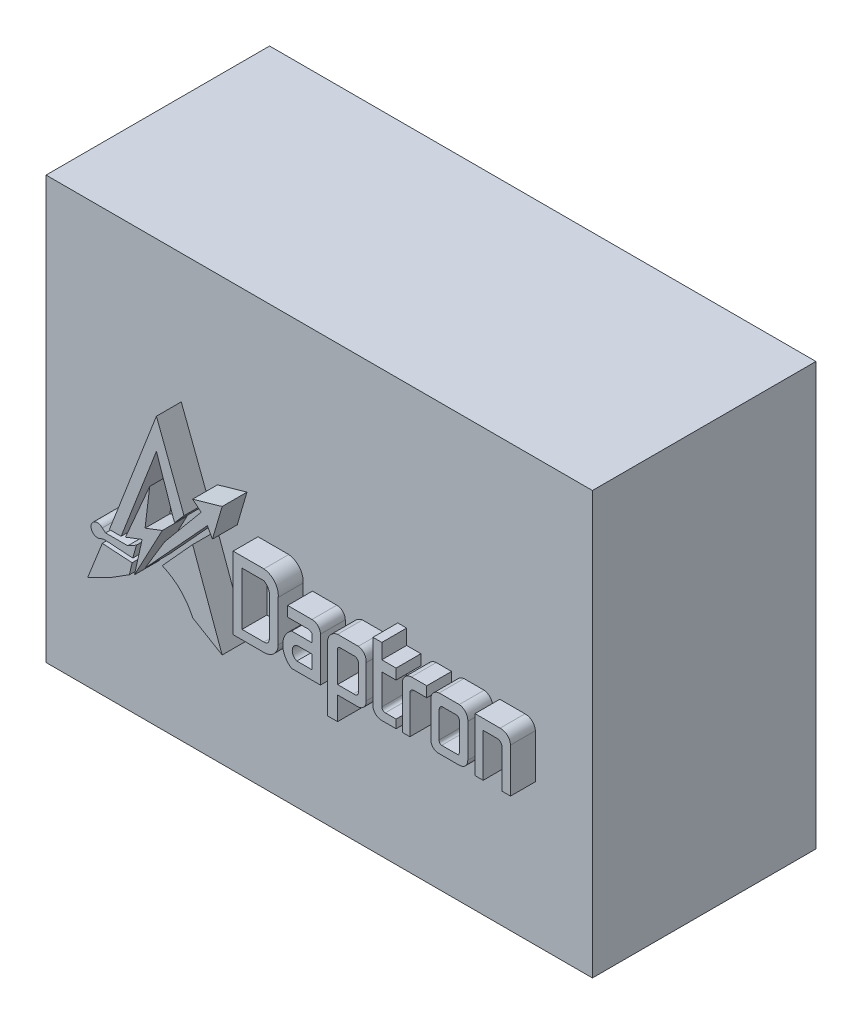
from build123d import *

# Parameters (mm, degrees)
BOSS_EXTRU_1_DEPTH    = 10
BOSS_EXTRU_1_2_DEPTH  = 10
BOSS_EXTRU_1_3_DEPTH  = 10
BOSS_EXTRU_1_4_DEPTH  = 10
BOSS_EXTRU_1_5_DEPTH  = 10
BOSS_EXTRU_1_6_DEPTH  = 10
BOSS_EXTRU_1_7_DEPTH  = 10
BOSS_EXTRU_1_8_DEPTH  = 10
BOSS_EXTRU_1_9_DEPTH  = 10
BOSS_EXTRU_1_10_DEPTH = 10
BOSS_EXTRU_1_11_DEPTH = 10
BOSS_EXTRU_1_12_DEPTH = 10
BOSS_EXTRU_1_13_DEPTH = 10
ESQUISSE2_W           = 22
ESQUISSE2_H           = 17
BOSS_EXTRU_2_DEPTH    = 9


with BuildPart() as part:
    # Esquisse1 → Boss.-Extru.1 (new body)
    with BuildSketch(Plane.XY):
        Polygon((5.443717547, 11.812499229), (3.550061207, 6.914484272), (4.023475292, 6.914484272), (5.443717547, 10.587995489), (6.172046909, 8.462184165), (6.554419824, 8.899181782), align=None)
    extrude(amount=BOSS_EXTRU_1_DEPTH)



with BuildPart() as body_2:
    # Esquisse1 → Boss.-Extru.1 2 (new body)
    with BuildSketch(Plane.XY):
        with BuildLine():
            Line((6.902626833, 8.065470566), (5.678236467, 6.71845465))
            ThreePointArc((5.678236467, 6.71845465), (6.407694377, 6.234618767), (6.902626833, 5.512643789))
            Line((6.902626833, 5.512643789), (8.09044996, 4.808141168))
            Line((8.09044996, 4.808141168), (6.902626833, 8.065470566))
        make_face()
    extrude(amount=BOSS_EXTRU_1_2_DEPTH)


with BuildPart() as body_3:
    # Esquisse1 → Boss.-Extru.1 3 (new body)
    with BuildSketch(Plane.XY):
        Polygon((7.496538396, 9.023251364), (4.987277184, 6.289858676), (5.776031703, 7.600137795), (7.245503612, 9.363504086), (6.902626833, 9.649234735), (8.09044996, 9.988029647), (7.698590784, 8.65325933), align=None)
    extrude(amount=BOSS_EXTRU_1_3_DEPTH)


with BuildPart() as body_4:
    # Esquisse1 → Boss.-Extru.1 4 (new body)
    with BuildSketch(Plane.XY):
        with BuildLine():
            ThreePointArc((19.283756817, 7.855107538), (19.571781089, 7.751485217), (19.70217296, 7.474549255))
            Line((19.70217296, 7.474549255), (19.70217296, 5.694123098))
            Line((19.70217296, 5.694123098), (19.357163158, 5.694123098))
            Line((19.357163158, 5.694123098), (19.357163158, 7.183832057))
            ThreePointArc((19.357163158, 7.183832057), (19.328585973, 7.343227565), (19.195669208, 7.435730089))
            Line((19.195669208, 7.435730089), (18.601077847, 7.435730089))
            Line((18.601077847, 7.435730089), (18.601077847, 5.694123098))
            Line((18.601077847, 5.694123098), (18.270749313, 5.694123098))
            Line((18.270749313, 5.694123098), (18.270749313, 7.855107538))
            Line((18.270749313, 7.855107538), (19.283756817, 7.855107538))
        make_face()
    extrude(amount=BOSS_EXTRU_1_4_DEPTH)


with BuildPart() as body_5:
    # Esquisse1 → Boss.-Extru.1 5 (new body)
    with BuildSketch(Plane.XY):
        with BuildLine():
            Line((16.494479646, 7.435730089), (16.494479646, 6.027121876))
            ThreePointArc((16.494479646, 6.027121876), (16.601754173, 5.813714283), (16.828510675, 5.738666872))
            Line((16.828510675, 5.738666872), (17.640470987, 5.738666872))
            ThreePointArc((17.640470987, 5.738666872), (17.880768825, 5.838201495), (17.980303448, 6.078499332))
            Line((17.980303448, 6.078499332), (17.980303448, 7.435730089))
            ThreePointArc((17.980303448, 7.435730089), (17.896289803, 7.716195302), (17.638564331, 7.855107538))
            Line((17.638564331, 7.855107538), (16.828516054, 7.855107538))
            ThreePointArc((16.828516054, 7.855107538), (16.574641936, 7.714600019), (16.494479646, 7.435730089))
        make_face()
        with BuildLine():
            Line((17.638564331, 7.273362699), (17.638564331, 6.215464578))
            ThreePointArc((17.638564331, 6.215464578), (17.633763509, 6.142841489), (17.599745165, 6.078499332))
            Line((17.599745165, 6.078499332), (16.929772089, 6.078499332))
            ThreePointArc((16.929772089, 6.078499332), (16.85077764, 6.126011144), (16.828516054, 6.215464578))
            Line((16.828516054, 6.215464578), (16.828516054, 7.273362699))
            ThreePointArc((16.828516054, 7.273362699), (16.85715067, 7.368261985), (16.929772089, 7.435730089))
            Line((16.929772089, 7.435730089), (17.537308296, 7.435730089))
            ThreePointArc((17.537308296, 7.435730089), (17.621563701, 7.375517206), (17.638564331, 7.273362699))
        make_face(mode=Mode.SUBTRACT)
    extrude(amount=BOSS_EXTRU_1_5_DEPTH)


with BuildPart() as body_6:
    # Esquisse1 → Boss.-Extru.1 6 (new body)
    with BuildSketch(Plane.XY):
        with BuildLine():
            ThreePointArc((15.811686316, 7.435730089), (15.697522048, 7.386612234), (15.651527288, 7.271154337))
            Line((15.651527288, 7.271154337), (15.651527288, 5.738666872))
            Line((15.651527288, 5.738666872), (15.345769144, 5.738666872))
            Line((15.345769144, 5.738666872), (15.345769144, 7.435730089))
            ThreePointArc((15.345769144, 7.435730089), (15.440912126, 7.720805224), (15.709766935, 7.855107538))
            Line((15.709766935, 7.855107538), (16.328563178, 7.855107538))
            Line((16.328563178, 7.855107538), (16.328563178, 7.435730089))
            Line((16.328563178, 7.435730089), (15.811686316, 7.435730089))
        make_face()
    extrude(amount=BOSS_EXTRU_1_6_DEPTH)


with BuildPart() as body_7:
    # Esquisse1 → Boss.-Extru.1 7 (new body)
    with BuildSketch(Plane.XY):
        with BuildLine():
            Line((14.161212762, 8.462184165), (14.161212762, 6.076587297))
            ThreePointArc((14.161212762, 6.076587297), (14.270058526, 5.833555854), (14.518873285, 5.738672251))
            Line((14.518873285, 5.738672251), (15.09368484, 5.738672251))
            Line((15.09368484, 5.738672251), (15.09368484, 6.076587297))
            Line((15.09368484, 6.076587297), (14.659382776, 6.076587297))
            ThreePointArc((14.659382776, 6.076587297), (14.560703645, 6.116109364), (14.518873285, 6.213832369))
            Line((14.518873285, 6.213832369), (14.518873285, 7.435730089))
            Line((14.518873285, 7.435730089), (15.09368484, 7.435730089))
            Line((15.09368484, 7.435730089), (15.09368484, 7.855107538))
            Line((15.09368484, 7.855107538), (14.518873285, 7.855107538))
            Line((14.518873285, 7.855107538), (14.518873285, 8.462184165))
            Line((14.518873285, 8.462184165), (14.161212762, 8.462184165))
        make_face()
    extrude(amount=BOSS_EXTRU_1_7_DEPTH)


with BuildPart() as body_8:
    # Esquisse1 → Boss.-Extru.1 8 (new body)
    with BuildSketch(Plane.XY):
        with BuildLine():
            ThreePointArc((13.886262231, 6.102623129), (13.805699319, 5.85605539), (13.574383017, 5.738672251))
            Line((13.574383017, 5.738672251), (12.738992267, 5.738672251))
            Line((12.738992267, 5.738672251), (12.738992267, 4.808141168))
            Line((12.738992267, 4.808141168), (12.338004706, 4.808141168))
            Line((12.338004706, 4.808141168), (12.338004706, 7.295933822))
            ThreePointArc((12.338004706, 7.295933822), (12.422689818, 7.658567923), (12.738992267, 7.855107538))
            Line((12.738992267, 7.855107538), (13.574383017, 7.855107538))
            ThreePointArc((13.574383017, 7.855107538), (13.817178537, 7.710011113), (13.886262231, 7.435730089))
            Line((13.886262231, 7.435730089), (13.886262231, 6.102623129))
        make_face()
        with BuildLine():
            Line((13.574383017, 7.295933822), (13.574383017, 6.213832369))
            ThreePointArc((13.574383017, 6.213832369), (13.502737587, 6.119010995), (13.38502778, 6.102623129))
            Line((13.38502778, 6.102623129), (12.738992267, 6.102623129))
            Line((12.738992267, 6.102623129), (12.738992267, 7.295933822))
            ThreePointArc((12.738992267, 7.295933822), (12.749024413, 7.381980031), (12.81696207, 7.435730089))
            Line((12.81696207, 7.435730089), (13.38502778, 7.435730089))
            ThreePointArc((13.38502778, 7.435730089), (13.508658154, 7.405048709), (13.574383017, 7.295933822))
        make_face(mode=Mode.SUBTRACT)
    extrude(amount=BOSS_EXTRU_1_8_DEPTH)


with BuildPart() as body_9:
    # Esquisse1 → Boss.-Extru.1 9 (new body)
    with BuildSketch(Plane.XY):
        with BuildLine():
            Line((10.727068381, 7.446462813), (11.468195577, 7.446462813))
            ThreePointArc((11.468195577, 7.446462813), (11.596758234, 7.435730089), (11.705162978, 7.365787542))
            Line((11.705162978, 7.365787542), (11.705162978, 7.043119919))
            Line((11.705162978, 7.043119919), (10.888410557, 7.043119919))
            ThreePointArc((10.888410557, 7.043119919), (10.530519911, 6.390896085), (10.888410557, 5.738672251))
            Line((10.888410557, 5.738672251), (12.047997327, 5.738672251))
            Line((12.047997327, 5.738672251), (12.047997327, 7.514651407))
            ThreePointArc((12.047997327, 7.514651407), (11.948280035, 7.755390246), (11.707541196, 7.855107538))
            Line((11.707541196, 7.855107538), (10.727068381, 7.855107538))
            Line((10.727068381, 7.855107538), (10.727068381, 7.446462813))
        make_face()
        with BuildLine():
            ThreePointArc((11.097631979, 6.65067692), (10.91259355, 6.376650024), (11.097631979, 6.102623129))
            Line((11.097631979, 6.102623129), (11.705154613, 6.102623129))
            Line((11.705154613, 6.102623129), (11.705154613, 6.65067692))
            Line((11.705154613, 6.65067692), (11.097631979, 6.65067692))
        make_face(mode=Mode.SUBTRACT)
    extrude(amount=BOSS_EXTRU_1_9_DEPTH)


with BuildPart() as body_10:
    # Esquisse1 → Boss.-Extru.1 10 (new body)
    with BuildSketch(Plane.XY):
        with BuildLine():
            Line((8.533065369, 5.73880671), (9.772658698, 5.73880671))
            ThreePointArc((9.772658698, 5.73880671), (10.174227228, 5.895270347), (10.34754256, 6.289858676))
            Line((10.34754256, 6.289858676), (10.34754256, 7.944071011))
            ThreePointArc((10.34754256, 7.944071011), (10.206978339, 8.417727517), (9.772658698, 8.65325933))
            Line((9.772658698, 8.65325933), (8.533065369, 8.65325933))
            Line((8.533065369, 8.65325933), (8.533065369, 5.73880671))
        make_face()
        with BuildLine():
            ThreePointArc((9.772658698, 6.102623129), (9.919227173, 6.151592523), (9.988240146, 6.289858676))
            Line((9.988240146, 6.289858676), (9.988240146, 7.944071011))
            ThreePointArc((9.988240146, 7.944071011), (9.912548031, 8.115618007), (9.772658698, 8.240472493))
            Line((9.772658698, 8.240472493), (8.892367783, 8.240472493))
            Line((8.892367783, 8.240472493), (8.892367783, 6.102623129))
            Line((8.892367783, 6.102623129), (9.772658698, 6.102623129))
        make_face(mode=Mode.SUBTRACT)
    extrude(amount=BOSS_EXTRU_1_10_DEPTH)


with BuildPart() as body_11:
    # Esquisse1 → Boss.-Extru.1 11 (new body)
    with BuildSketch(Plane.XY):
        Polygon((4.355542191, 5.73880671), (4.464623497, 6.213832369), (3.265683859, 6.289858676), (2.677895095, 4.808141168), (3.633556258, 5.286480868), align=None)
    extrude(amount=BOSS_EXTRU_1_11_DEPTH)


with BuildPart() as body_12:
    # Esquisse1 → Boss.-Extru.1 12 (new body)
    with BuildSketch(Plane.XY):
        Polygon((4.199345564, 6.972570668), (5.173183133, 9.229859022), (4.987277184, 7.680642785), (5.678236467, 7.944071011), (4.560132448, 5.83905846), (4.868736322, 7.227775894), align=None)
    extrude(amount=BOSS_EXTRU_1_12_DEPTH)


with BuildPart() as body_13:
    # Esquisse1 → Boss.-Extru.1 13 (new body)
    with BuildSketch(Plane.XY):
        with BuildLine():
            Line((4.49284458, 6.389276558), (3.344161613, 6.46328358))
            Line((3.344161613, 6.46328358), (3.204994268, 6.426280069))
            ThreePointArc((3.204994268, 6.426280069), (2.812494667, 6.690009625), (3.265683859, 6.825023594))
            Line((3.265683859, 6.825023594), (3.396366031, 6.71845465))
            Line((3.396366031, 6.71845465), (4.291345624, 6.71845465))
            Line((4.291345624, 6.71845465), (4.640038971, 6.914484272))
            Line((4.640038971, 6.914484272), (4.49284458, 6.389276558))
        make_face()
    extrude(amount=BOSS_EXTRU_1_13_DEPTH)


with BuildPart() as part_1:
    add(part.part)

    add(body_2.part)  # Boss.-Extru.2 merges body 2

    add(body_3.part)  # Boss.-Extru.2 merges body 3

    add(body_4.part)  # Boss.-Extru.2 merges body 4

    add(body_5.part)  # Boss.-Extru.2 merges body 5

    add(body_6.part)  # Boss.-Extru.2 merges body 6

    add(body_7.part)  # Boss.-Extru.2 merges body 7

    add(body_8.part)  # Boss.-Extru.2 merges body 8

    add(body_9.part)  # Boss.-Extru.2 merges body 9

    add(body_10.part)  # Boss.-Extru.2 merges body 10

    add(body_11.part)  # Boss.-Extru.2 merges body 11

    add(body_12.part)  # Boss.-Extru.2 merges body 12

    add(body_13.part)  # Boss.-Extru.2 merges body 13
    # Esquisse2 → Boss.-Extru.2 (add)
    with BuildSketch(Plane.XY):
        with Locations((11, 8.5)):
            Rectangle(ESQUISSE2_W, ESQUISSE2_H)
    extrude(amount=BOSS_EXTRU_2_DEPTH)


solid = part_1.part
